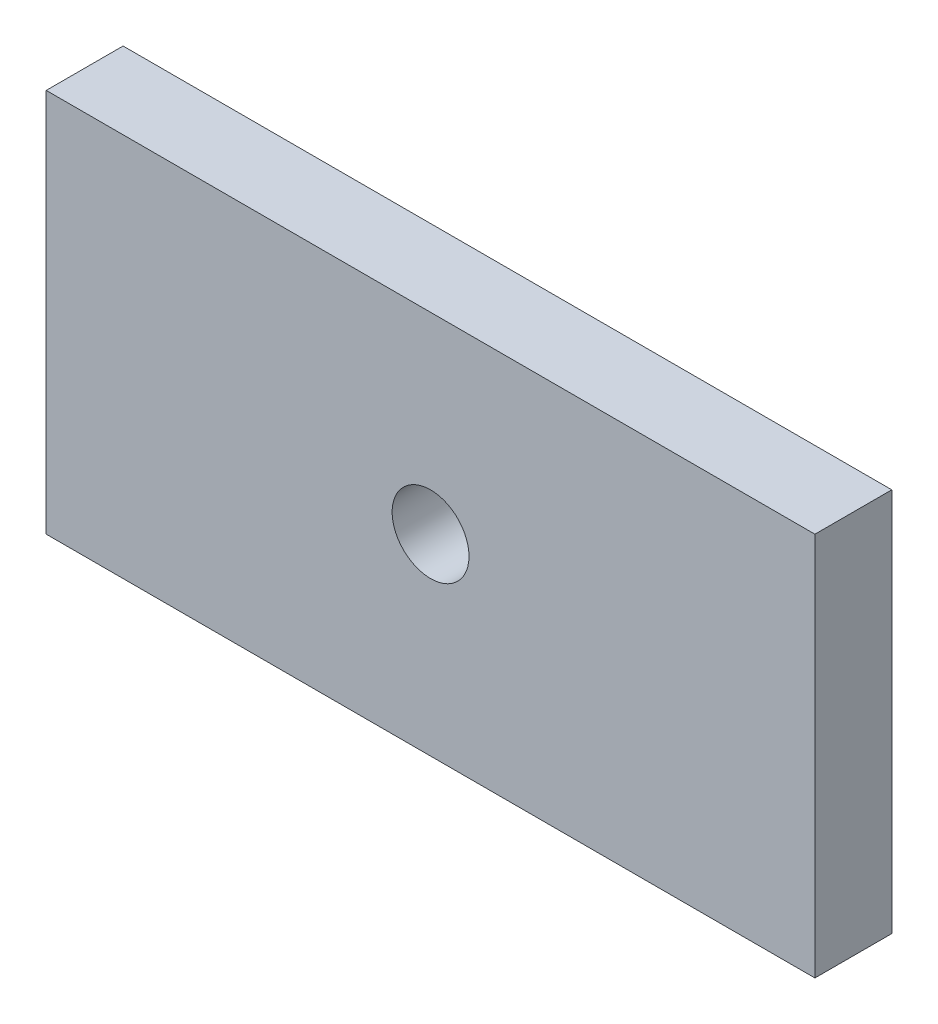
from build123d import *

# Parameters (mm, degrees)
SKETCH_1_W      = 100
SKETCH_1_H      = 50
SKETCH_1_R      = 5
EXTRUDE_1_DEPTH = 10


with BuildPart() as part:
    # 草图1 → 凸台-拉伸1 (new body)
    with BuildSketch(Plane.XY):
        Rectangle(SKETCH_1_W, SKETCH_1_H)
        Circle(SKETCH_1_R, mode=Mode.SUBTRACT)
    extrude(amount=EXTRUDE_1_DEPTH)


solid = part.part
